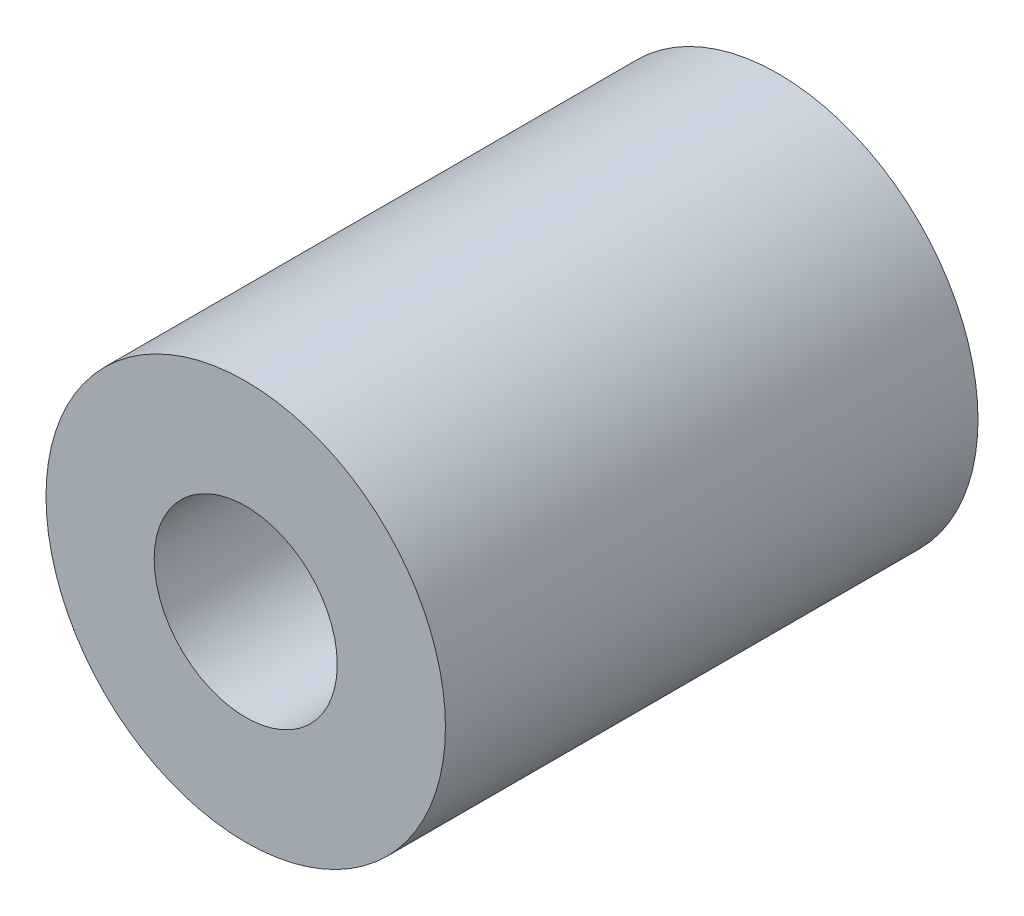
from build123d import *

# Parameters (mm, degrees)
SKETCH1_R           = 3
SKETCH1_R_2         = 1.375
BOSS_EXTRUDE1_DEPTH = 8


with BuildPart() as part:
    # Sketch1 → Boss-Extrude1 (new body)
    with BuildSketch(Plane.XY):
        Circle(SKETCH1_R)
        Circle(SKETCH1_R_2, mode=Mode.SUBTRACT)
    extrude(amount=BOSS_EXTRUDE1_DEPTH)


solid = part.part
